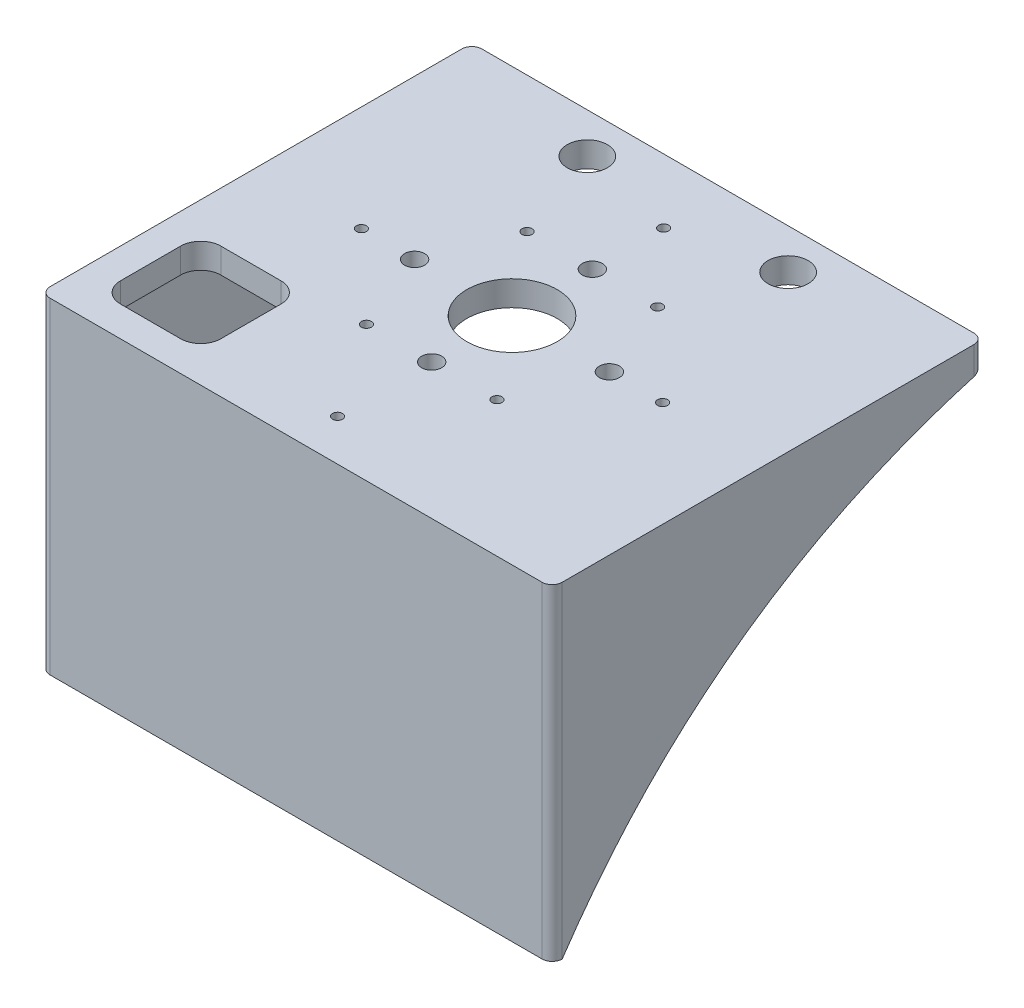
from build123d import *

# Parameters (mm, degrees)
SKETCH1_W           = 51
SKETCH1_H           = 43
SKETCH1_R           = 4.5
SKETCH1_R_2         = 1
SKETCH1_R_3         = 2
SKETCH1_R_4         = 0.5
BOSS_EXTRUDE1_DEPTH = 2.5
FILLET1_R           = 1
BOSS_EXTRUDE2_DEPTH = 30
CUT_EXTRUDE1_DEPTH  = 67


with BuildPart() as part:
    # Sketch1 → Boss-Extrude1 (new body)
    with BuildSketch(Plane(origin=(0, 0, 0), x_dir=(1, 0, 0), z_dir=(0, 1, 0))):
        Rectangle(SKETCH1_W, SKETCH1_H)
        with Locations(Location((0, 0, 0), (0, 0, 270))):
            Circle(SKETCH1_R, mode=Mode.SUBTRACT)
        with Locations(Location((9.7, 0, 0), (0, 0, 270))):
            Circle(SKETCH1_R_2, mode=Mode.SUBTRACT)
        with Locations(Location((-9.7, 0, 0), (0, 0, 270))):
            Circle(SKETCH1_R_2, mode=Mode.SUBTRACT)
        with Locations(Location((0, 8, 0), (0, 0, 270))):
            Circle(SKETCH1_R_2, mode=Mode.SUBTRACT)
        with Locations(Location((0, -8, 0), (0, 0, 270))):
            Circle(SKETCH1_R_2, mode=Mode.SUBTRACT)
        with Locations(Location((-10, 17.5, 0), (0, 0, 270))):
            Circle(SKETCH1_R_3, mode=Mode.SUBTRACT)
        with Locations(Location((10, 17.5, 0), (0, 0, 270))):
            Circle(SKETCH1_R_3, mode=Mode.SUBTRACT)
        with Locations(Location((-15, 0, 0), (0, 0, 270))):
            Circle(SKETCH1_R_4, mode=Mode.SUBTRACT)
        with Locations(Location((15, 0, 0), (0, 0, 270))):
            Circle(SKETCH1_R_4, mode=Mode.SUBTRACT)
        with Locations(Location((0, -17.375333522, 0), (0, 0, 270))):
            Circle(SKETCH1_R_4, mode=Mode.SUBTRACT)
        with Locations(Location((0, 15.103719109, 0), (0, 0, 270))):
            Circle(SKETCH1_R_4, mode=Mode.SUBTRACT)
        with Locations(Location((6.5, 8, 0), (0, 0, 270))):
            Circle(SKETCH1_R_4, mode=Mode.SUBTRACT)
        with Locations(Location((-6.5, 8, 0), (0, 0, 270))):
            Circle(SKETCH1_R_4, mode=Mode.SUBTRACT)
        with Locations(Location((-6.5, -8, 0), (0, 0, 270))):
            Circle(SKETCH1_R_4, mode=Mode.SUBTRACT)
        with Locations(Location((6.5, -8, 0), (0, 0, 270))):
            Circle(SKETCH1_R_4, mode=Mode.SUBTRACT)
        with BuildLine():
            Line((-20.5, -18.5), (-14.5, -18.5))
            ThreePointArc((-14.5, -18.5), (-13.085786438, -17.914213562), (-12.5, -16.5))
            Line((-12.5, -16.5), (-12.5, -10.5))
            ThreePointArc((-12.5, -10.5), (-13.085786438, -9.085786438), (-14.5, -8.5))
            Line((-14.5, -8.5), (-20.5, -8.5))
            ThreePointArc((-20.5, -8.5), (-21.914213562, -9.085786438), (-22.5, -10.5))
            Line((-22.5, -10.5), (-22.5, -16.5))
            ThreePointArc((-22.5, -16.5), (-21.914213562, -17.914213562), (-20.5, -18.5))
        make_face(mode=Mode.SUBTRACT)
    extrude(amount=BOSS_EXTRUDE1_DEPTH)

    # Fillet1
    fillet1_edges = [part.edges().sort_by_distance(p)[0] for p in [
        (25.5, 1.25, -21.5),
        (25.5, 1.25, 21.5),
        (-25.5, 1.25, 21.5),
        (-25.5, 1.25, -21.5),
    ]]
    fillet(fillet1_edges, radius=FILLET1_R)

    # Sketch2 → Boss-Extrude2 (add)
    with BuildSketch(Plane.XZ):
        with BuildLine():
            Line((-23.5, -21.5), (-23.5, 18.5))
            ThreePointArc((-23.5, 18.5), (-23.207106781, 19.207106781), (-22.5, 19.5))
            Line((-22.5, 19.5), (22.5, 19.5))
            ThreePointArc((22.5, 19.5), (23.207106781, 19.207106781), (23.5, 18.5))
            Line((23.5, 18.5), (23.5, -21.5))
            Line((23.5, -21.5), (24.5, -21.5))
            ThreePointArc((24.5, -21.5), (25.207106781, -21.207106781), (25.5, -20.5))
            Line((25.5, -20.5), (25.5, 20.5))
            ThreePointArc((25.5, 20.5), (25.207106781, 21.207106781), (24.5, 21.5))
            Line((24.5, 21.5), (-24.5, 21.5))
            ThreePointArc((-24.5, 21.5), (-25.207106781, 21.207106781), (-25.5, 20.5))
            Line((-25.5, 20.5), (-25.5, -20.5))
            ThreePointArc((-25.5, -20.5), (-25.207106781, -21.207106781), (-24.5, -21.5))
            Line((-24.5, -21.5), (-23.5, -21.5))
        make_face()
    extrude(amount=BOSS_EXTRUDE2_DEPTH)

    # Sketch3 → Cut-Extrude1 (cut)
    with BuildSketch(Plane(origin=(25.5, 0, 0), x_dir=(0, 0, -1), z_dir=(1, 0, 0))):
        with BuildLine():
            add(Edge.make_bspline(
                [(-20.5, -30), (-5.501277344, -7.754009084), (20.5, -0.280836845)],
                knots=[0, 0, 0, 0.981207698, 0.981207698, 0.981207698], degree=2))
            Line((-20.5, -30), (20.5, -30))
            Line((20.5, -30), (20.5, -0.280836845))
        make_face()
        with BuildLine():
            Line((20.5, -30), (-20.5, -30))
            Line((-20.5, -30), (-11.71480256, -35.881315146))
            Line((-11.71480256, -35.881315146), (34.782094199, -34.613217961))
            Line((34.782094199, -34.613217961), (27.415053414, -3.212716254))
            Line((27.415053414, -3.212716254), (21.5, 0))
            add(Edge.make_bspline(
                [(20.5, -0.280836845), (20.997982091, -0.137709033), (21.5, 0)],
                knots=[0.981207698, 0.981207698, 0.981207698, 1, 1, 1], degree=2))
            Line((20.5, -0.280836845), (20.5, -30))
        make_face()
    extrude(amount=-CUT_EXTRUDE1_DEPTH, mode=Mode.SUBTRACT)


solid = part.part
